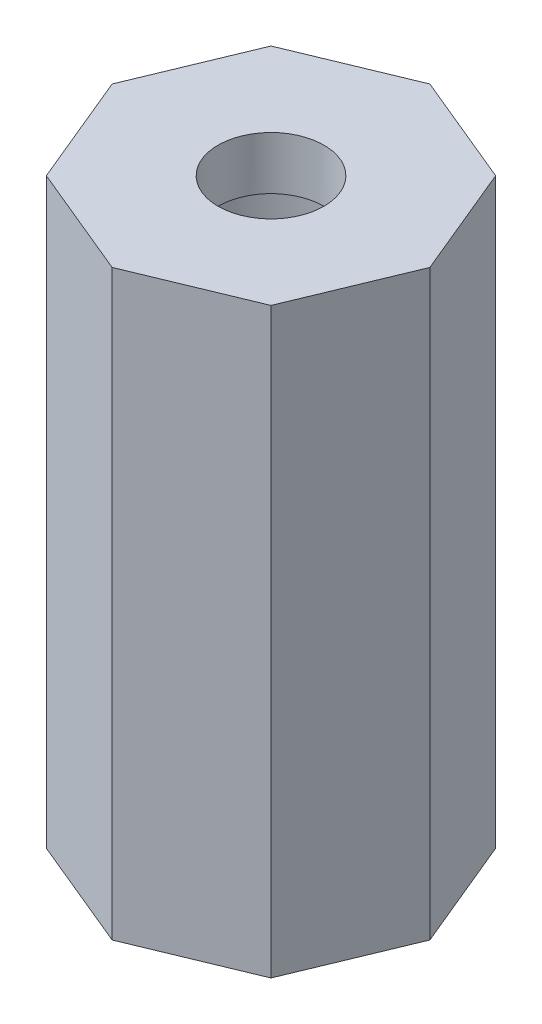
from build123d import *

# Parameters (mm, degrees)
BOSS_EXTRUDE1_DEPTH = 110
SKETCH2_R           = 10
CUT_EXTRUDE1_DEPTH  = 110
SKETCH3_R           = 20
CUT_EXTRUDE2_DEPTH  = 100


with BuildPart() as part:
    # Sketch1 → Boss-Extrude1 (new body)
    with BuildSketch(Plane(origin=(0, 0, 0), x_dir=(1, 0, 0), z_dir=(0, 1, 0))):
        Polygon((30, 0), (21.213203436, 21.213203436), (0, 30), (-21.213203436, 21.213203436), (-30, 0), (-21.213203436, -21.213203436), (0, -30), (21.213203436, -21.213203436), align=None)
    extrude(amount=BOSS_EXTRUDE1_DEPTH)

    # Sketch2 → Cut-Extrude1 (cut)
    with BuildSketch(Plane(origin=(0, 110, 0), x_dir=(1, 0, 0), z_dir=(0, 1, 0))):
        with Locations(Location((0, 0, 0), (0, 0, 270))):
            Circle(SKETCH2_R)
    extrude(amount=-CUT_EXTRUDE1_DEPTH, mode=Mode.SUBTRACT)

    # Sketch3 → Cut-Extrude2 (cut)
    with BuildSketch(Plane.XZ):
        with Locations(Location((0, 0, 0), (0, 0, 270))):
            Circle(SKETCH3_R)
    extrude(amount=-CUT_EXTRUDE2_DEPTH, mode=Mode.SUBTRACT)


solid = part.part
